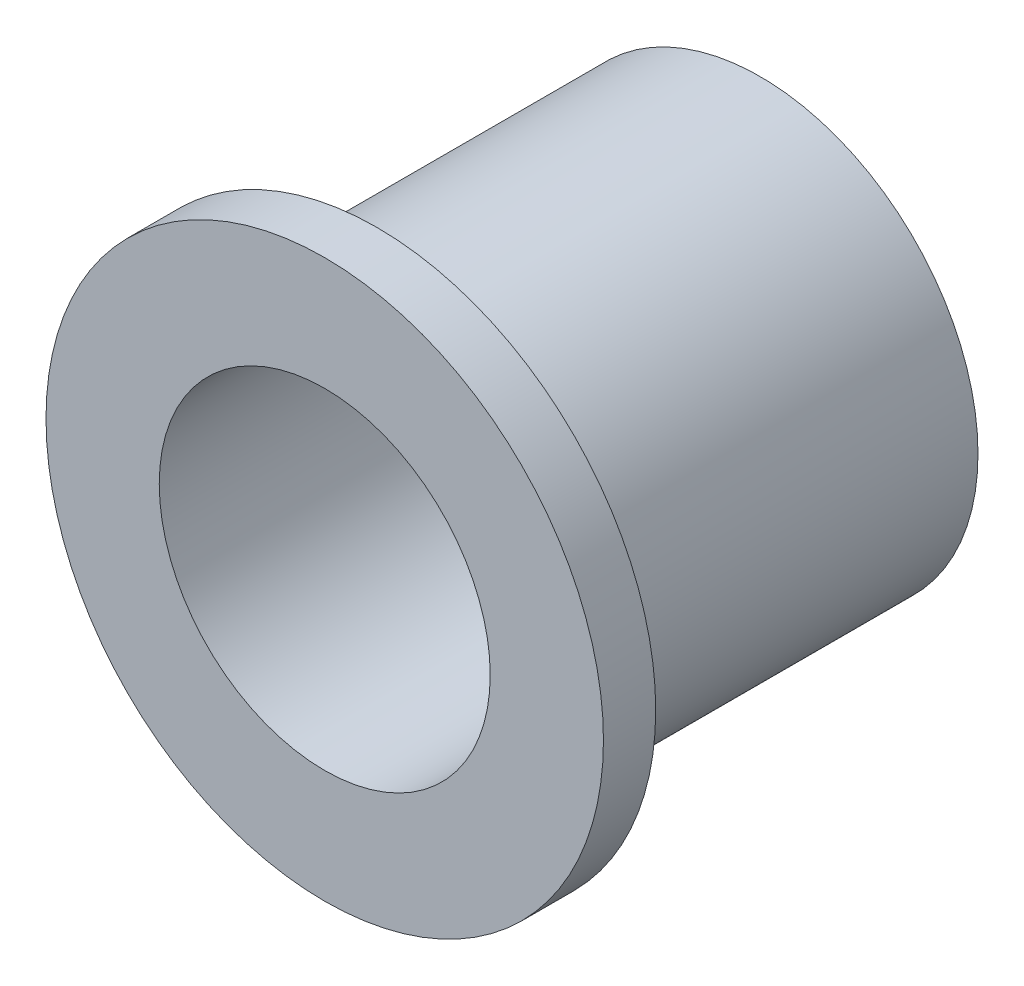
from build123d import *

# Parameters (mm, degrees)
CROQUIS1_R              = 12.5
SALIENTE_EXTRUIR1_DEPTH = 22
CROQUIS2_R              = 16
SALIENTE_EXTRUIR2_DEPTH = 3
CROQUIS3_R              = 9.5
CORTAR_EXTRUIR1_DEPTH   = 34.7194306


with BuildPart() as part:
    # Croquis1 → Saliente-Extruir1 (new body)
    with BuildSketch(Plane.XY):
        Circle(CROQUIS1_R)
    extrude(amount=SALIENTE_EXTRUIR1_DEPTH)

    # Croquis2 → Saliente-Extruir2 (add)
    with BuildSketch(Plane.XY.offset(22)):
        Circle(CROQUIS2_R)
    extrude(amount=SALIENTE_EXTRUIR2_DEPTH)

    # Croquis3 → Cortar-Extruir1 (cut, through all)
    with BuildSketch(Plane.XY.offset(25)):
        Circle(CROQUIS3_R)
    extrude(amount=-CORTAR_EXTRUIR1_DEPTH, mode=Mode.SUBTRACT)


solid = part.part
